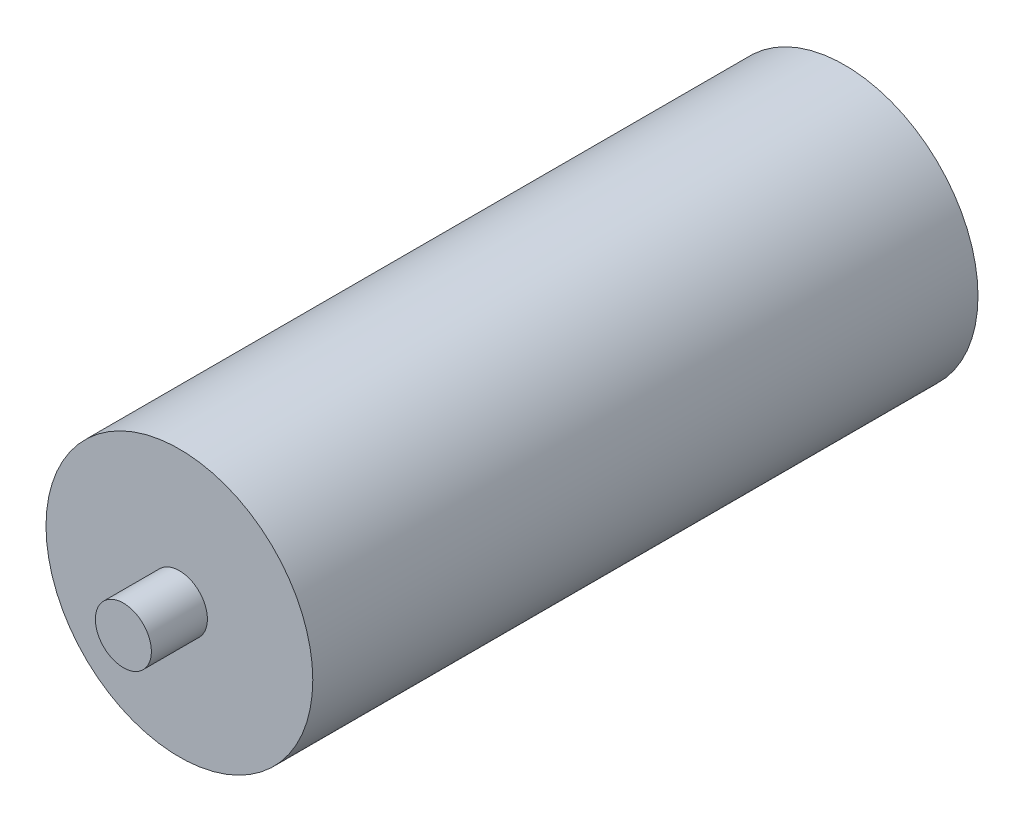
from build123d import *

# Parameters (mm, degrees)
SKETCH1_R           = 19.05
BOSS_EXTRUDE1_DEPTH = 47.498
SKETCH1_3_R         = 4
BOSS_EXTRUDE2_DEPTH = 55.498


with BuildPart() as part:
    # Sketch1 → Boss-Extrude1 (new, symmetric)
    with BuildSketch(Plane.XY):
        Circle(SKETCH1_R)
    extrude(amount=BOSS_EXTRUDE1_DEPTH, both=True)

    # Sketch1<3> → Boss-Extrude2 (add, symmetric)
    with BuildSketch(Plane.XY):
        Circle(SKETCH1_3_R)
    extrude(amount=BOSS_EXTRUDE2_DEPTH, both=True)


solid = part.part
